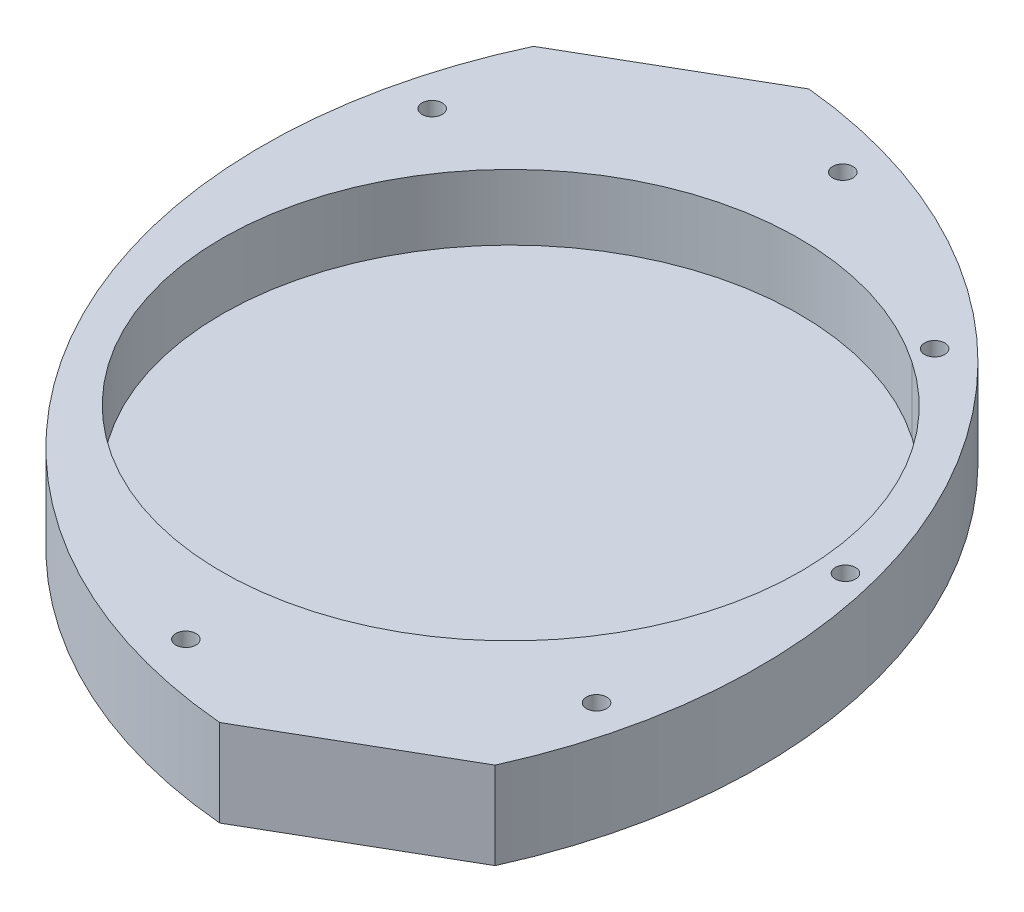
from build123d import *

# Parameters (mm, degrees)
BOSS_EXTRUDE1_DEPTH      = 8.255
SKETCH2_R                = 4.52165068
CUT_EXTRUDE1_DEPTH       = 24.892
BOSS_EXTRUDE2_DEPTH      = 2.54
BOSS_EXTRUDE2_DEPTH_BACK = 19.05
BOSS_EXTRUDE3_DEPTH      = 55.87439679
SKETCH8_W                = 306.493093546
SKETCH8_H                = 19.05
BOSS_EXTRUDE4_DEPTH      = 55.87439679
SKETCH9_R                = 88.9
BOSS_EXTRUDE5_DEPTH      = 19.05
SKETCH10_W               = 191.766813877
SKETCH10_H               = 13.52799874
BOSS_EXTRUDE6_DEPTH      = 55.87439679
SKETCH12_R               = 1.75
CUT_EXTRUDE3_DEPTH       = 25.146
SKETCH14_R               = 12.700759967
CUT_EXTRUDE4_DEPTH       = 30.48
CUT_EXTRUDE5_DEPTH       = 55.118
SKETCH16_R               = 79.375
CUT_EXTRUDE6_DEPTH       = 16.129
CUT_EXTRUDE7_DEPTH       = 8.89
CUT_EXTRUDE8_DEPTH       = 2.54
SKETCH19_W               = 282.174011185
SKETCH19_H               = 80.01
CUT_EXTRUDE9_DEPTH       = 75.946
SKETCH20_R               = 79.375
BOSS_EXTRUDE7_DEPTH      = 19.05
SKETCH21_R               = 2.8
SKETCH21_R_2             = 2.794
CUT_EXTRUDE10_DEPTH      = 9.1
SKETCH22_R               = 79.375
CUT_EXTRUDE11_DEPTH      = 18.161
BOSS_EXTRUDE8_DEPTH      = 5.08
SKETCH24_R               = 80.01
CUT_EXTRUDE12_DEPTH      = 18.161


with BuildPart() as part:
    # Sketch1 → Boss-Extrude1 (new, symmetric)
    with BuildSketch(Plane(origin=(0, 0, 0), x_dir=(1, 0, 0), z_dir=(0, 1, 0))):
        Polygon((-26.685513069, 19.73834527), (-3.435840979, 33.16154971), (26.859514241, -19.311544765), (3.609842152, -32.734749204), align=None)
    extrude(amount=BOSS_EXTRUDE1_DEPTH, both=True)

    # Sketch2 → Cut-Extrude1 (cut)
    with BuildSketch(Plane(origin=(0, 8.255, 0), x_dir=(1, 0, 0), z_dir=(0, 1, 0))):
        with Locations(Location((0, 0, 0), (0, 0, 270))):
            Circle(SKETCH2_R)
    extrude(amount=-CUT_EXTRUDE1_DEPTH, mode=Mode.SUBTRACT)

    # Sketch12 → Cut-Extrude3 (cut)
    with BuildSketch(Plane(origin=(0, 8.255, 0), x_dir=(1, 0, 0), z_dir=(0, 1, 0))):
        with Locations(Location((-3.182842434, 15.553762143, 0), (0, 0, 270))):
            Circle(SKETCH12_R)
        with Locations(Location((3.182843419, -15.553761764, 0), (0, 0, 270))):
            Circle(SKETCH12_R)
        with Locations(Location((-11.87853102, 10.533303997, 0), (0, 0, 270))):
            Circle(SKETCH12_R)
        with Locations(Location((11.878532006, -10.533303617, 0), (0, 0, 270))):
            Circle(SKETCH12_R)
    extrude(amount=-CUT_EXTRUDE3_DEPTH, mode=Mode.SUBTRACT)


with BuildPart() as body_2:
    # Sketch3 → Boss-Extrude2 (new, two sides: drawn at the far end of the back side and taken through both)
    with BuildSketch(Plane(origin=(0, 8.255, 0), x_dir=(1, 0, 0), z_dir=(0, 1, 0)).offset(-BOSS_EXTRUDE2_DEPTH_BACK)):
        Polygon((-10.314271596, 73.739239236), (-58.702918637, 45.802040841), (10.314271596, -73.739239236), (58.702918637, -45.802040841), align=None)
        Polygon((-26.685513069, 19.73834527), (3.609842152, -32.734749204), (26.859514241, -19.311544765), (-3.435840979, 33.16154971), align=None, mode=Mode.SUBTRACT)
    extrude(amount=BOSS_EXTRUDE2_DEPTH + BOSS_EXTRUDE2_DEPTH_BACK)

    # Sketch7 → Boss-Extrude3 (add)
    with BuildSketch(Plane(origin=(-24.19432352, 0, 13.968599197), x_dir=(0.5000000000000003, 0, 0.8660254037844384), z_dir=(-0.8660254037844385, 0, 0.5000000000000004))):
        Polygon((-90.607190232, 10.795), (-118.92932164, -90.805), (-97.33932164, -90.805), (-69.017190232, -10.795), (-69.017190232, 10.795), align=None)
    boss_extrude3 = extrude(amount=-BOSS_EXTRUDE3_DEPTH)

    # Sketch8 → Boss-Extrude4 (add)
    with BuildSketch(Plane(origin=(-24.19432352, 0, 13.968599197), x_dir=(0.5000000000000003, 0, 0.8660254037844384), z_dir=(-0.8660254037844385, 0, 0.5000000000000004))):
        with Locations((0, -100.33)):
            Rectangle(SKETCH8_W, SKETCH8_H)
    extrude(amount=-BOSS_EXTRUDE4_DEPTH)

    # Mirror1: Boss-Extrude3 across plane
    add(boss_extrude3.mirror(Plane(origin=(-0.070654873, 0, -0.122377831), x_dir=(-0.8660254037844366, 0, 0.5000000000000038), z_dir=(0.5000000000000041, 0, 0.8660254037844364))))

    # Sketch9 → Boss-Extrude5 (add)
    with BuildSketch(Plane(origin=(0, -90.805, 0), x_dir=(1, 0, 0), z_dir=(0, 1, 0))):
        Circle(SKETCH9_R)
    extrude(amount=-BOSS_EXTRUDE5_DEPTH)

    # Sketch10 → Boss-Extrude6 (add)
    with BuildSketch(Plane(origin=(-24.19432352, 0, 13.968599197), x_dir=(0.5000000000000047, 0, 0.866025403784436), z_dir=(-0.866025403784436, 0, 0.5000000000000047))):
        with Locations((-2.1166315, -68.398848488)):
            Rectangle(SKETCH10_W, SKETCH10_H)
    extrude(amount=-BOSS_EXTRUDE6_DEPTH)

    # Sketch14 → Cut-Extrude4 (cut)
    with BuildSketch(Plane(origin=(0, 10.795, 0), x_dir=(1, 0, 0), z_dir=(0, 1, 0))):
        with Locations(Location((24.120133011, -48.16621031, 0), (0, 0, 270))):
            Circle(SKETCH14_R)
    cut_extrude4 = extrude(amount=-CUT_EXTRUDE4_DEPTH, mode=Mode.SUBTRACT)

    # Mirror2: Cut-Extrude4 across plane
    add(cut_extrude4.mirror(Plane(origin=(-0.070654873, 0, -0.122377831), x_dir=(-0.8660254037844366, 0, 0.5000000000000038), z_dir=(0.5000000000000041, 0, 0.8660254037844364))), mode=Mode.SUBTRACT)

    # Sketch15 → Cut-Extrude5 (cut)
    with BuildSketch(Plane(origin=(0, -90.805, 0), x_dir=(1, 0, 0), z_dir=(0, 1, 0))):
        Polygon((100.817596907, -118.746803351), (83.517674594, -88.782458937), (35.129027553, -116.719657331), (52.428949866, -146.684001745), align=None)
        Polygon((-83.658984341, 89.027214598), (-35.2703373, 116.964412993), (-52.428949866, 146.684001745), (-100.817596907, 118.746803351), align=None)
    extrude(amount=-CUT_EXTRUDE5_DEPTH, mode=Mode.SUBTRACT)

    # Sketch16 → Cut-Extrude6 (cut)
    with BuildSketch(Plane(origin=(0, -90.805, 0), x_dir=(1, 0, 0), z_dir=(0, 1, 0))):
        with Locations(Location((0, 0, 0), (0, 0, 270))):
            Circle(SKETCH16_R)
    extrude(amount=-CUT_EXTRUDE6_DEPTH, mode=Mode.SUBTRACT)


with BuildPart() as cut_extrude7_tool:
    # Sketch17 → Cut-Extrude7 (new body)
    with BuildSketch(Plane(origin=(0, 10.795, 0), x_dir=(1, 0, 0), z_dir=(0, 1, 0))):
        Polygon((27.82393906, -104.066872908), (76.212586101, -76.129674513), (-31.017857396, 109.598901741), (-79.406504437, 81.661703346), align=None)
    extrude(amount=-CUT_EXTRUDE7_DEPTH)


with BuildPart() as part_1:
    add(part.part)

    # Cut-Extrude7: cut by cut_extrude7_tool
    add(cut_extrude7_tool.part, mode=Mode.SUBTRACT)

    # Sketch18 → Cut-Extrude8 (cut)
    with BuildSketch(Plane(origin=(0, 1.905, 0), x_dir=(1, 0, 0), z_dir=(0, 1, 0))):
        Polygon((-26.685513069, 19.73834527), (3.609842152, -32.734749204), (26.859514241, -19.311544765), (-3.435840979, 33.16154971), align=None)
    extrude(amount=-CUT_EXTRUDE8_DEPTH, mode=Mode.SUBTRACT)


with BuildPart() as body_2_1:
    add(body_2.part)

    # Cut-Extrude7: cut by cut_extrude7_tool
    add(cut_extrude7_tool.part, mode=Mode.SUBTRACT)

    # Sketch19 → Cut-Extrude9 (cut)
    with BuildSketch(Plane(origin=(-24.19432352, 0, 13.968599197), x_dir=(0.5000000000000047, 0, 0.866025403784436), z_dir=(-0.866025403784436, 0, 0.5000000000000047))):
        with Locations((-0.70763264, -50.8)):
            Rectangle(SKETCH19_W, SKETCH19_H)
    extrude(amount=-CUT_EXTRUDE9_DEPTH, mode=Mode.SUBTRACT)


with BuildPart() as cut_extrude9_piece_1:
    # of the separate pieces the step leaves, piece 1, a body of its own (cut_extrude9_pieces)
    add(body_2_1.part.solids().sort_by_distance((-83.658984341, -90.805, -89.027214598))[0])

    # Sketch20 → Boss-Extrude7 (add)
    with BuildSketch(Plane.XZ.offset(109.855)):
        with BuildLine():
            Line((-83.658984341, -89.027214598), (-35.2703373, -116.964412993))
            ThreePointArc((-35.2703373, -116.964412993), (76.919154391, -44.572464934), (83.517674594, 88.782458937))
            Line((83.517674594, 88.782458937), (35.129027553, 116.719657331))
            ThreePointArc((35.129027553, 116.719657331), (-77.953106839, 44.843076777), (-83.658984341, -89.027214598))
        make_face()
        with Locations(Location((0, 0, 0), (0, 0, 90))):
            Circle(SKETCH20_R, mode=Mode.SUBTRACT)
    extrude(amount=-BOSS_EXTRUDE7_DEPTH)

    # Sketch21 → Cut-Extrude10 (cut)
    with BuildSketch(Plane(origin=(0, -90.805, 0), x_dir=(1, 0, 0), z_dir=(0, 1, 0))):
        with Locations(Location((-10.611856409, 101.680071559, 0), (0, 0, 270))):
            Circle(SKETCH21_R)
        with Locations(Location((-82.751596824, 60.030173011, 0), (0, 0, 270))):
            Circle(SKETCH21_R)
        with Locations(Location((82.610287077, -59.78541735, 0), (0, 0, 270))):
            Circle(SKETCH21_R)
        with Locations(Location((10.470546662, -101.435315897, 0), (0, 0, 270))):
            Circle(SKETCH21_R)
        with Locations(Location((44.477086399, 72.035469588, 0), (0, 0, 270))):
            Circle(SKETCH21_R_2)
        with Locations(Location((86.011031333, 5.793902801, 0), (0, 0, 270))):
            Circle(SKETCH21_R_2)
    extrude(amount=-CUT_EXTRUDE10_DEPTH, mode=Mode.SUBTRACT)

    # Sketch22 → Cut-Extrude11 (cut)
    with BuildSketch(Plane(origin=(0, -90.805, 0), x_dir=(1, 0, 0), z_dir=(0, 1, 0))):
        with Locations(Location((0, 0, 0), (0, 0, 270))):
            Circle(SKETCH22_R)
    extrude(amount=-CUT_EXTRUDE11_DEPTH, mode=Mode.SUBTRACT)

    # Sketch23 → Boss-Extrude8 (add)
    with BuildSketch(Plane.XZ.offset(109.855)):
        with BuildLine():
            Line((-83.658984341, -89.027214598), (-35.2703373, -116.964412993))
            ThreePointArc((-35.2703373, -116.964412993), (76.919154391, -44.572464934), (83.517674594, 88.782458937))
            Line((83.517674594, 88.782458937), (35.129027553, 116.719657331))
            ThreePointArc((35.129027553, 116.719657331), (-77.953106839, 44.843076777), (-83.658984341, -89.027214598))
        make_face()
    extrude(amount=BOSS_EXTRUDE8_DEPTH)

    # Sketch24 → Cut-Extrude12 (cut)
    with BuildSketch(Plane(origin=(0, -90.805, 0), x_dir=(1, 0, 0), z_dir=(0, 1, 0))):
        with Locations((-0.739793922, -0.263949779)):
            Circle(SKETCH24_R)
    extrude(amount=-CUT_EXTRUDE12_DEPTH, mode=Mode.SUBTRACT)


with BuildPart() as cut_extrude9_piece_2:
    # of the separate pieces the step leaves, piece 2, a body of its own (cut_extrude9_pieces)
    add(body_2_1.part.solids().sort_by_distance((-70.737011886, 1.905, -66.645701772))[0])


with BuildPart() as cut_extrude9_piece_2_1:
    # Body-Move/Copy1: moved
    add(cut_extrude9_piece_2.part.moved(Location((0, -38.1, 0))))


with BuildPart() as part_2:
    # Body-Move/Copy1: moved
    add(part_1.part.moved(Location((0, -38.1, 0))))


with BuildPart() as cut_extrude9_piece_2_2:
    add(cut_extrude9_piece_2_1.part)

    # Combine1: union part
    add(part_2.part)


solid = cut_extrude9_piece_1.part
